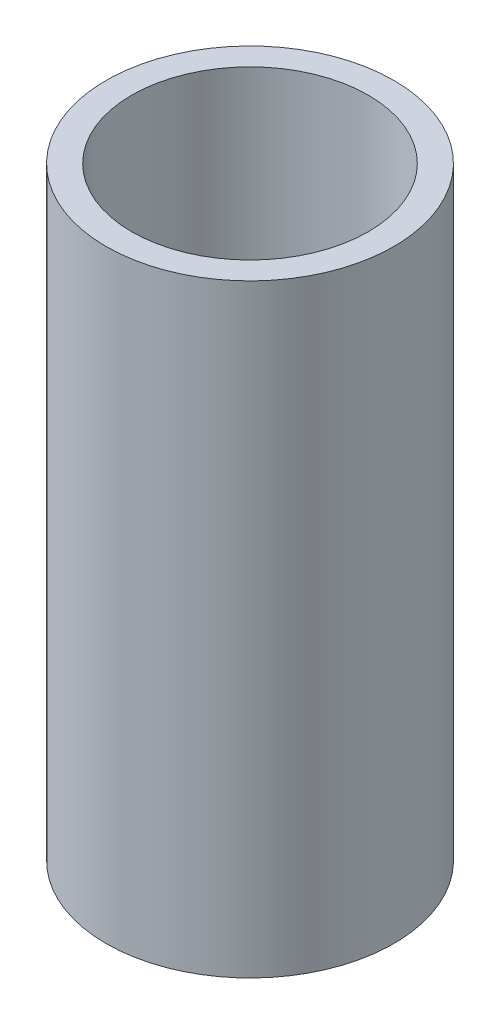
from build123d import *

# Parameters (mm, degrees)
SKETCH1_R           = 9.652
SKETCH1_R_2         = 7.9375
BOSS_EXTRUDE1_DEPTH = 40.5


with BuildPart() as part:
    # Sketch1 → Boss-Extrude1 (new body)
    with BuildSketch(Plane(origin=(0, 0, 0), x_dir=(1, 0, 0), z_dir=(0, 1, 0))):
        with Locations(Location((0, 0, 0), (0, 0, 270))):
            Circle(SKETCH1_R)
        with Locations(Location((0, 0, 0), (0, 0, 270))):
            Circle(SKETCH1_R_2, mode=Mode.SUBTRACT)
    extrude(amount=BOSS_EXTRUDE1_DEPTH)


solid = part.part
